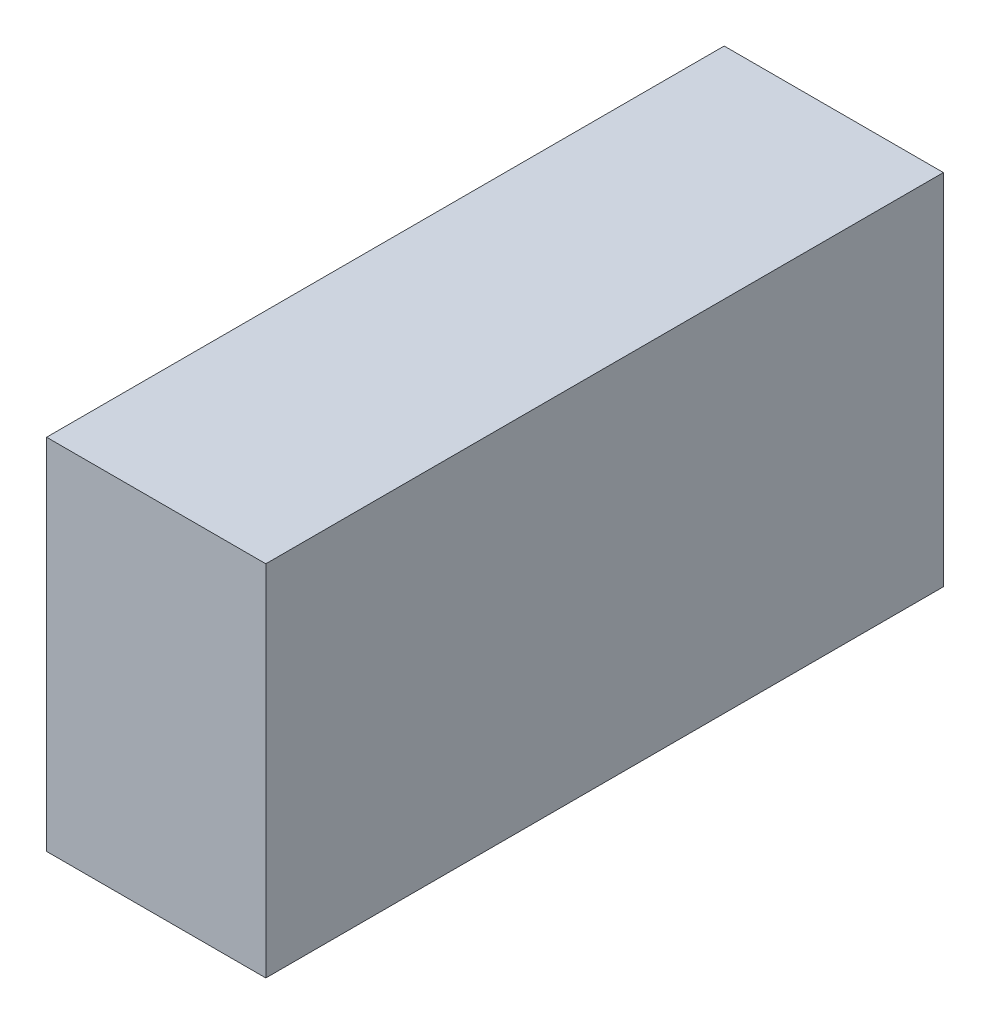
from build123d import *

# Parameters (mm, degrees)
SKETCH1_W           = 34
SKETCH1_H           = 18
BOSS_EXTRUDE1_DEPTH = 11


with BuildPart() as part:
    # Sketch1 → Boss-Extrude1 (new body)
    with BuildSketch(Plane(origin=(17, 0, 0), x_dir=(0, 0, -1), z_dir=(1, 0, 0))):
        with Locations((20, 14)):
            Rectangle(SKETCH1_W, SKETCH1_H)
    extrude(amount=BOSS_EXTRUDE1_DEPTH)


solid = part.part
